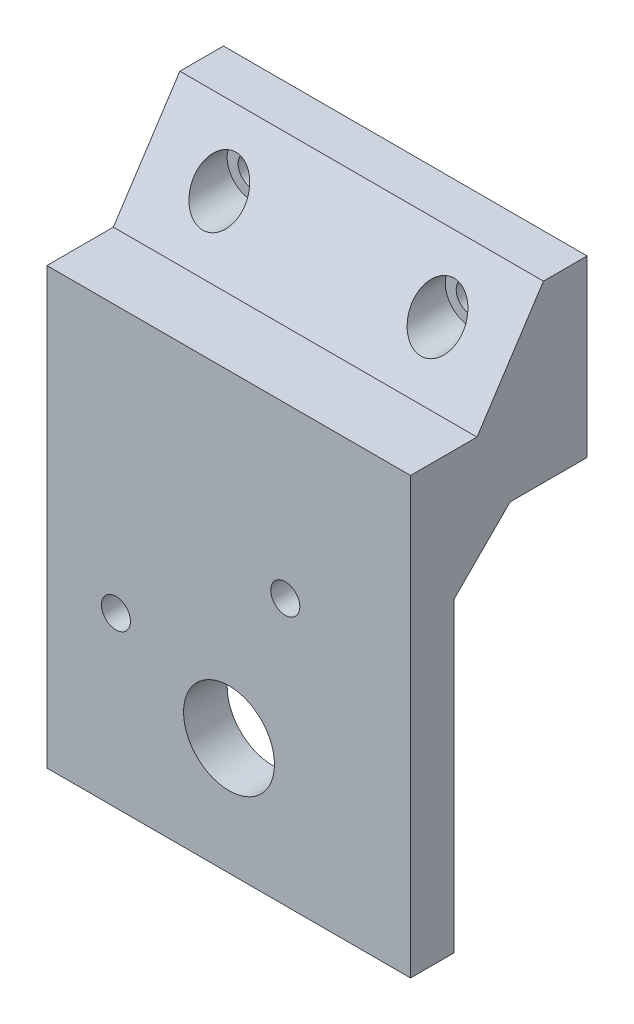
from build123d import *

# Parameters (mm, degrees)
SKETCH1_W            = 50
SKETCH1_H            = 18
BOSS_EXTRUDE1_DEPTH  = 7
SKETCH2_W            = 50
SKETCH2_H            = 8
BOSS_EXTRUDE2_DEPTH  = 6.7
SKETCH3_W            = 7
SKETCH3_H            = 8
BOSS_EXTRUDE3_DEPTH  = 23
SKETCH4_W            = 7
SKETCH4_H            = 8
BOSS_EXTRUDE4_DEPTH  = 14
SKETCH5_W            = 50
SKETCH5_H            = 10
CUT_EXTRUDE1_DEPTH   = 14
SKETCH6_R            = 2
CUT_EXTRUDE2_DEPTH   = 14
SKETCH7_W            = 50
SKETCH7_H            = 6
BOSS_EXTRUDE5_DEPTH  = 67.91
CUT_EXTRUDE3_DEPTH   = 35
SKETCH9_R            = 2
CUT_EXTRUDE5_DEPTH   = 35
SKETCH13_W           = 14
SKETCH13_H           = 8
CUT_EXTRUDE6_DEPTH   = 10
SKETCH14_W           = 7.7
SKETCH14_H           = 8
CUT_EXTRUDE7_DEPTH   = 120
SKETCH15_W           = 50
SKETCH15_H           = 14
BOSS_EXTRUDE6_DEPTH  = 6.4
SKETCH16_W           = 50
SKETCH16_H           = 14
CUT_EXTRUDE8_DEPTH   = 6
BOSS_EXTRUDE7_DEPTH  = 50
SKETCH18_R           = 2
CUT_EXTRUDE9_DEPTH   = 6.4
SKETCH19_R           = 3.5
CUT_EXTRUDE10_DEPTH  = 6.4
SKETCH20_W           = 12.4
SKETCH20_H           = 26.067854841
CUT_EXTRUDE11_DEPTH  = 70
SKETCH21_W           = 50
SKETCH21_H           = 6
BOSS_EXTRUDE8_DEPTH  = 10
SKETCH22_W           = 50
SKETCH22_H           = 10
BOSS_EXTRUDE9_DEPTH  = 18.28
SKETCH23_W           = 50
SKETCH23_H           = 6
BOSS_EXTRUDE10_DEPTH = 14
SKETCH24_R           = 2
CUT_EXTRUDE12_DEPTH  = 14
BOSS_EXTRUDE11_DEPTH = 50
SKETCH26_R           = 3.5
CUT_EXTRUDE13_DEPTH  = 14
SKETCH27_W           = 16.816450925
SKETCH27_H           = 29.203857669
BOSS_EXTRUDE12_DEPTH = 6
SKETCH28_R           = 6.25
CUT_EXTRUDE14_DEPTH  = 10


with BuildPart() as part:
    # Sketch1 → Boss-Extrude1 (new body)
    with BuildSketch(Plane.XY):
        with Locations((-12.394067797, 1.955508475)):
            Rectangle(SKETCH1_W, SKETCH1_H)
    extrude(amount=BOSS_EXTRUDE1_DEPTH)

    # Sketch2 → Boss-Extrude2 (add)
    with BuildSketch(Plane.XY.offset(7)):
        with Locations((-12.394067797, 6.955508475)):
            Rectangle(SKETCH2_W, SKETCH2_H)
    extrude(amount=BOSS_EXTRUDE2_DEPTH)

    # Sketch3 → Boss-Extrude3 (add)
    with BuildSketch(Plane(origin=(12.605932203, 0, 0), x_dir=(0, 0, -1), z_dir=(1, 0, 0))):
        with Locations((-3.5, 6.955508475)):
            Rectangle(SKETCH3_W, SKETCH3_H)
    extrude(amount=BOSS_EXTRUDE3_DEPTH)

    # Sketch4 → Boss-Extrude4 (add)
    with BuildSketch(Plane.ZY.offset(37.394067797)):
        with Locations((3.5, 6.955508475)):
            Rectangle(SKETCH4_W, SKETCH4_H)
    extrude(amount=BOSS_EXTRUDE4_DEPTH)

    # Sketch5 → Cut-Extrude1 (cut)
    with BuildSketch(Plane.XY.offset(7)):
        with Locations((-12.394067797, -2.044491525)):
            Rectangle(SKETCH5_W, SKETCH5_H)
    extrude(amount=-CUT_EXTRUDE1_DEPTH, mode=Mode.SUBTRACT)

    # Sketch6 → Cut-Extrude2 (cut)
    with BuildSketch(Plane.XY.offset(7)):
        with Locations((19.605932203, 6.955508475)):
            Circle(SKETCH6_R)
        with Locations((28.605932203, 6.955508475)):
            Circle(SKETCH6_R)
    extrude(amount=-CUT_EXTRUDE2_DEPTH, mode=Mode.SUBTRACT)

    # Sketch7 → Boss-Extrude5 (add)
    with BuildSketch(Plane.XZ.offset(-2.955508475)):
        with Locations((-12.394067797, 10.7)):
            Rectangle(SKETCH7_W, SKETCH7_H)
    extrude(amount=BOSS_EXTRUDE5_DEPTH)

    # Sketch8 → Cut-Extrude3 (cut)
    with BuildSketch(Plane.XY.offset(13.7)):
        with BuildLine():
            Line((-4.394067797, -44.33115583), (-4.394067797, -64.954491525))
            ThreePointArc((-4.394067797, -64.954491525), (-12.394067797, -72.954491525), (-20.394067797, -64.954491525))
            Line((-20.394067797, -64.954491525), (-20.394067797, -44.33115583))
            ThreePointArc((-20.394067797, -44.33115583), (-12.394067797, -36.33115583), (-4.394067797, -44.33115583))
        make_face()
    extrude(amount=-CUT_EXTRUDE3_DEPTH, mode=Mode.SUBTRACT)

    # Sketch9 → Cut-Extrude5 (cut)
    with BuildSketch(Plane(origin=(0, 0, 7.7), x_dir=(-1, 0, 0), z_dir=(0, 0, -1))):
        with Locations((27.901028765, -41.756933891)):
            Circle(SKETCH9_R)
        with Locations((4.616687569, -28.370715783)):
            Circle(SKETCH9_R)
    extrude(amount=-CUT_EXTRUDE5_DEPTH, mode=Mode.SUBTRACT)

    # Sketch13 → Cut-Extrude6 (cut)
    with BuildSketch(Plane.XY.offset(7)):
        with Locations((-44.394067797, 6.955508475)):
            Rectangle(SKETCH13_W, SKETCH13_H)
    extrude(amount=-CUT_EXTRUDE6_DEPTH, mode=Mode.SUBTRACT)

    # Sketch14 → Cut-Extrude7 (cut)
    with BuildSketch(Plane.ZY.offset(37.394067797)):
        with Locations((3.85, 6.955508475)):
            Rectangle(SKETCH14_W, SKETCH14_H)
    extrude(amount=-CUT_EXTRUDE7_DEPTH, mode=Mode.SUBTRACT)

    # Sketch15 → Boss-Extrude6 (add)
    with BuildSketch(Plane(origin=(0, 0, 7.7), x_dir=(-1, 0, 0), z_dir=(0, 0, -1))):
        with Locations((12.394067797, 3.955508475)):
            Rectangle(SKETCH15_W, SKETCH15_H)
    extrude(amount=BOSS_EXTRUDE6_DEPTH)

    # Sketch16 → Cut-Extrude8 (cut)
    with BuildSketch(Plane.XY.offset(13.7)):
        with Locations((-12.394067797, 3.955508475)):
            Rectangle(SKETCH16_W, SKETCH16_H)
    extrude(amount=-CUT_EXTRUDE8_DEPTH, mode=Mode.SUBTRACT)


with BuildPart() as cut_extrude8_piece_1:
    # of the separate pieces the step leaves, piece 1, a body of its own (cut_extrude8_pieces)
    add(part.part.solids().sort_by_distance((-37.394067797, -64.954491525, 13.7))[0])



with BuildPart() as cut_extrude8_piece_2:
    # of the separate pieces the step leaves, piece 2, a body of its own (cut_extrude8_pieces)
    add(part.part.solids().sort_by_distance((12.605932203, 10.955508475, 7.7))[0])


with BuildPart() as cut_extrude8_piece_1_1:
    add(cut_extrude8_piece_1.part)

    add(cut_extrude8_piece_2.part)  # Boss-Extrude7 merges Cut-Extrude8 piece 2
    # Sketch17 → Boss-Extrude7 (add)
    with BuildSketch(Plane.ZY.offset(37.394067797)):
        Polygon((7.7, 10.955508475), (13.7, -3.044491525), (7.7, -3.044491525), align=None)
        Polygon((1.3, -3.044491525), (7.7, -14.780389578), (7.7, -3.044491525), align=None)
    extrude(amount=-BOSS_EXTRUDE7_DEPTH)

    # Sketch18 → Cut-Extrude9 (cut)
    with BuildSketch(Plane(origin=(0, 0, 1.3), x_dir=(-1, 0, 0), z_dir=(0, 0, -1))):
        with Locations((-5.605932203, 3.955508475)):
            Circle(SKETCH18_R)
        with Locations((30.394067797, 4.955341008)):
            Circle(SKETCH18_R)
    extrude(amount=-CUT_EXTRUDE9_DEPTH, mode=Mode.SUBTRACT)

    # Sketch19 → Cut-Extrude10 (cut)
    with BuildSketch(Plane(origin=(0, 0, 7.7), x_dir=(-1, 0, 0), z_dir=(0, 0, -1))):
        with Locations((30.394067797, 4.955341008)):
            Circle(SKETCH19_R)
        with Locations((-5.605932203, 3.955508475)):
            Circle(SKETCH19_R)
    extrude(amount=-CUT_EXTRUDE10_DEPTH, mode=Mode.SUBTRACT)

    # Sketch20 → Cut-Extrude11 (cut)
    with BuildSketch(Plane.ZY.offset(37.394067797)):
        with Locations((7.5, -2.078418946)):
            Rectangle(SKETCH20_W, SKETCH20_H)
    extrude(amount=-CUT_EXTRUDE11_DEPTH, mode=Mode.SUBTRACT)

    # Sketch21 → Boss-Extrude8 (add)
    with BuildSketch(Plane(origin=(0, -15.112346366, 0), x_dir=(1, 0, 0), z_dir=(0, 1, 0))):
        with Locations((-12.394067797, -10.7)):
            Rectangle(SKETCH21_W, SKETCH21_H)
    extrude(amount=BOSS_EXTRUDE8_DEPTH)

    # Sketch22 → Boss-Extrude9 (add)
    with BuildSketch(Plane(origin=(0, 0, 7.7), x_dir=(-1, 0, 0), z_dir=(0, 0, -1))):
        with Locations((12.394067797, -10.112346366)):
            Rectangle(SKETCH22_W, SKETCH22_H)
    extrude(amount=BOSS_EXTRUDE9_DEPTH)

    # Sketch23 → Boss-Extrude10 (add)
    with BuildSketch(Plane(origin=(0, -5.112346366, 0), x_dir=(1, 0, 0), z_dir=(0, 1, 0))):
        with Locations((-12.394067797, 7.58)):
            Rectangle(SKETCH23_W, SKETCH23_H)
    extrude(amount=BOSS_EXTRUDE10_DEPTH)

    # Sketch24 → Cut-Extrude12 (cut)
    with BuildSketch(Plane.XY.offset(-4.58)):
        with Locations((2.605932203, 1.887653634)):
            Circle(SKETCH24_R)
        with Locations((-27.394067797, 1.887653634)):
            Circle(SKETCH24_R)
    extrude(amount=-CUT_EXTRUDE12_DEPTH, mode=Mode.SUBTRACT)

    # Sketch25 → Boss-Extrude11 (add)
    with BuildSketch(Plane.ZY.offset(37.394067797)):
        Polygon((7.7, -15.112346366), (0, -15.112346366), (7.7, -22.812346366), align=None)
        Polygon((-4.58, -5.112346366), (4.56, -5.112346366), (-4.58, 8.887653634), align=None)
    extrude(amount=-BOSS_EXTRUDE11_DEPTH)

    # Sketch26 → Cut-Extrude13 (cut)
    with BuildSketch(Plane(origin=(0, 0, -4.58), x_dir=(-1, 0, 0), z_dir=(0, 0, -1))):
        with Locations((27.394067797, 1.887653634)):
            Circle(SKETCH26_R)
        with Locations((-2.605932203, 1.887653634)):
            Circle(SKETCH26_R)
    extrude(amount=-CUT_EXTRUDE13_DEPTH, mode=Mode.SUBTRACT)

    # Sketch27 → Boss-Extrude12 (add)
    with BuildSketch(Plane(origin=(0, 0, 7.7), x_dir=(-1, 0, 0), z_dir=(0, 0, -1))):
        with Locations((11.985842335, -50.352562691)):
            Rectangle(SKETCH27_W, SKETCH27_H)
    extrude(amount=-BOSS_EXTRUDE12_DEPTH)

    # Sketch28 → Cut-Extrude14 (cut)
    with BuildSketch(Plane(origin=(0, 0, 7.7), x_dir=(-1, 0, 0), z_dir=(0, 0, -1))):
        with Locations((12.354948295, -48.879390068)):
            Circle(SKETCH28_R)
    extrude(amount=-CUT_EXTRUDE14_DEPTH, mode=Mode.SUBTRACT)


solid = cut_extrude8_piece_1_1.part
